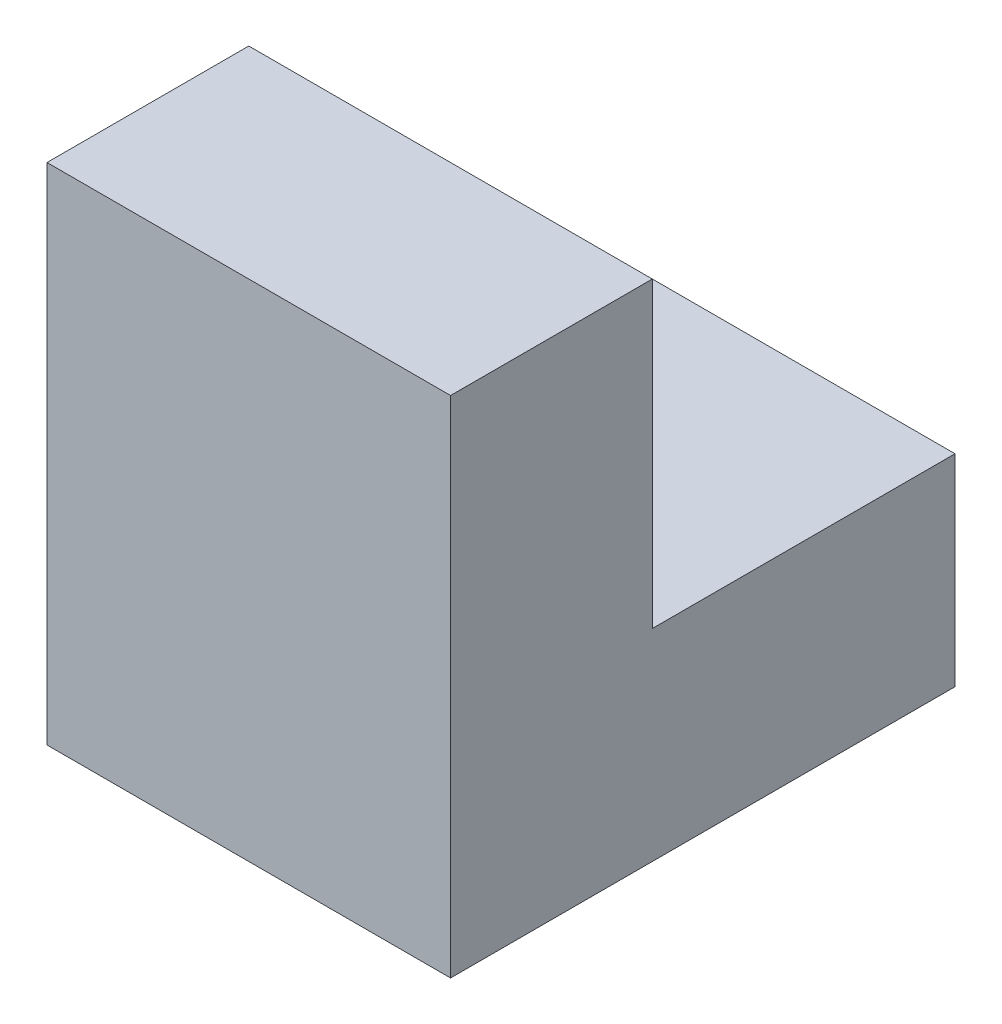
from build123d import *

# Parameters (mm, degrees)
BOSS_EXTRUDE1_DEPTH = 40


with BuildPart() as part:
    # Sketch2 → Boss-Extrude1 (new body)
    with BuildSketch(Plane(origin=(0, 0, 0), x_dir=(0, 0, -1), z_dir=(1, 0, 0))):
        Polygon((0, 50), (0, 0), (50, 0), (50, 20), (20, 20), (20, 50), align=None)
    extrude(amount=BOSS_EXTRUDE1_DEPTH)


solid = part.part
